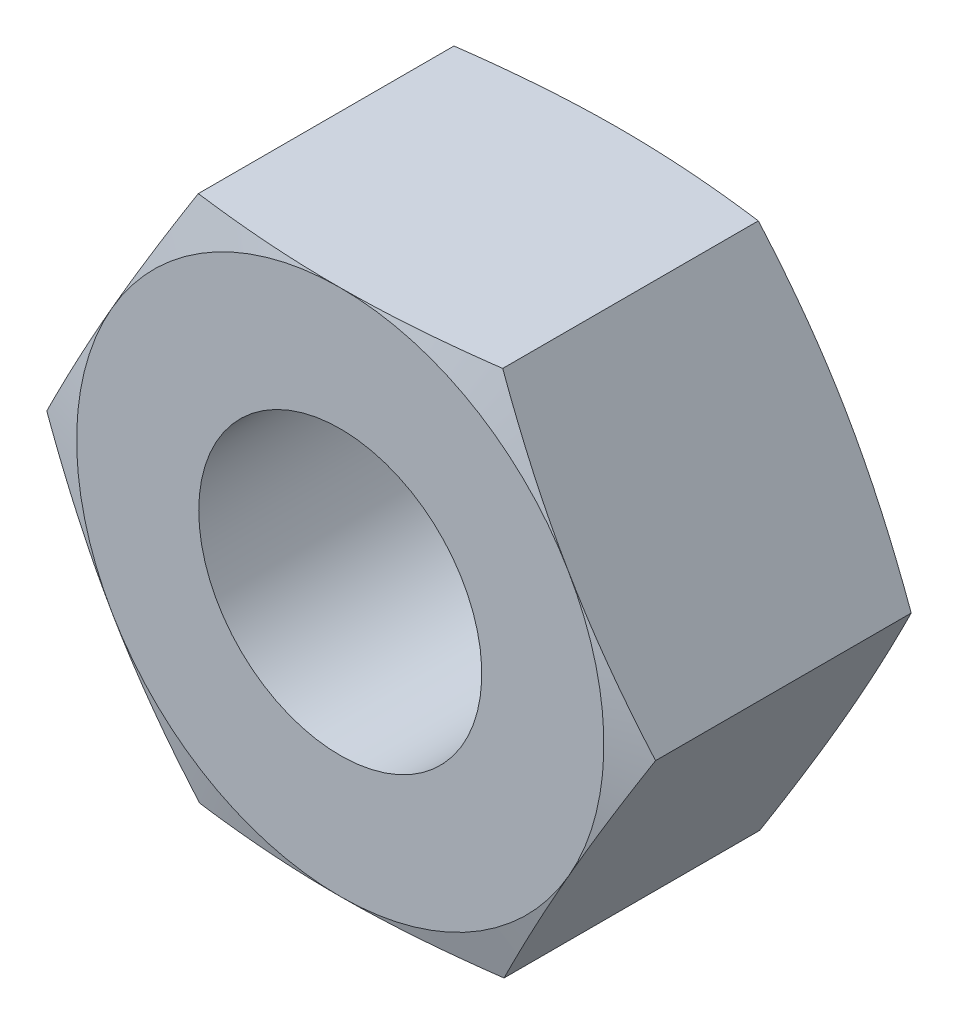
from build123d import *

# Parameters (mm, degrees)
RESSALTO_EXTRUS_O1_DEPTH = 10
ESBO_O2_OUTSIDE_W        = 142.044
ESBO_O2_OUTSIDE_H        = 139.132
ESBO_O2_OUTSIDE_R        = 9.5
CORTE_EXTRUS_O1_DEPTH    = 15
CORTE_EXTRUS_O1_DRAFT    = -75
ESBO_O3_OUTSIDE_W        = 142.044
ESBO_O3_OUTSIDE_H        = 139.132
ESBO_O3_OUTSIDE_R        = 9.5
CORTE_EXTRUS_O2_DEPTH    = 15
CORTE_EXTRUS_O2_DRAFT    = -75
FURO_ROSCADO_DE_M121_D   = 10.2


with BuildPart() as part:
    # Esboço1 → Ressalto-extrusão1 (new body)
    with BuildSketch(Plane.XY):
        Polygon((5.460449769, 9.51403288), (-5.509169282, 9.485904657), (-10.969619052, -0.028128224), (-5.460449769, -9.51403288), (5.509169282, -9.485904657), (10.969619052, 0.028128224), align=None)
    extrude(amount=RESSALTO_EXTRUS_O1_DEPTH)


with BuildPart() as corte_extrus_o1_tool:
    # Esboço2 outside → Corte-extrusão1 (with draft: the straight prism first)
    with BuildSketch(Plane.XY.offset(10)):
        Rectangle(ESBO_O2_OUTSIDE_W, ESBO_O2_OUTSIDE_H)
        Circle(ESBO_O2_OUTSIDE_R, mode=Mode.SUBTRACT)
    extrude(amount=-CORTE_EXTRUS_O1_DEPTH)
    # Corte-extrusão1: the draft: its side faces are tilted about the plane it starts from
    corte_extrus_o1_sides = [corte_extrus_o1_tool.faces().sort_by_distance(p)[0] for p in [
        (0, -69.566, 2.5),
        (71.022, 0, 2.5),
        (0, 69.566, 2.5),
        (-71.022, 0, 2.5),
        (-9.5, 0, 2.5),
    ]]
    draft(corte_extrus_o1_sides, Plane.XY.offset(10), CORTE_EXTRUS_O1_DRAFT)


with BuildPart() as part_1:
    add(part.part)

    # Corte-extrusão1: cut by corte_extrus_o1_tool
    add(corte_extrus_o1_tool.part, mode=Mode.SUBTRACT)


with BuildPart() as corte_extrus_o2_tool:
    # Esboço3 outside → Corte-extrusão2 (with draft: the straight prism first)
    with BuildSketch(Plane(origin=(0, 0, 0), x_dir=(-1, 0, 0), z_dir=(0, 0, -1))):
        Rectangle(ESBO_O3_OUTSIDE_W, ESBO_O3_OUTSIDE_H)
        Circle(ESBO_O3_OUTSIDE_R, mode=Mode.SUBTRACT)
    extrude(amount=-CORTE_EXTRUS_O2_DEPTH)
    # Corte-extrusão2: the draft: its side faces are tilted about the plane it starts from
    corte_extrus_o2_sides = [corte_extrus_o2_tool.faces().sort_by_distance(p)[0] for p in [
        (0, -69.566, 7.5),
        (-71.022, 0, 7.5),
        (0, 69.566, 7.5),
        (71.022, 0, 7.5),
        (9.5, 0, 7.5),
    ]]
    draft(corte_extrus_o2_sides, Plane(origin=(0, 0, 0), x_dir=(-1, 0, 0), z_dir=(0, 0, -1)), CORTE_EXTRUS_O2_DRAFT)


with BuildPart() as part_2:
    add(part_1.part)

    # Corte-extrusão2: cut by corte_extrus_o2_tool
    add(corte_extrus_o2_tool.part, mode=Mode.SUBTRACT)

    # Furo roscado de M121 (through all)
    with Locations(Plane(origin=(0, 0, 0), x_dir=(-1, 0, 0), z_dir=(0, 0, -1))):
        with Locations((0, 0)):
            Hole(FURO_ROSCADO_DE_M121_D / 2)


solid = part_2.part
